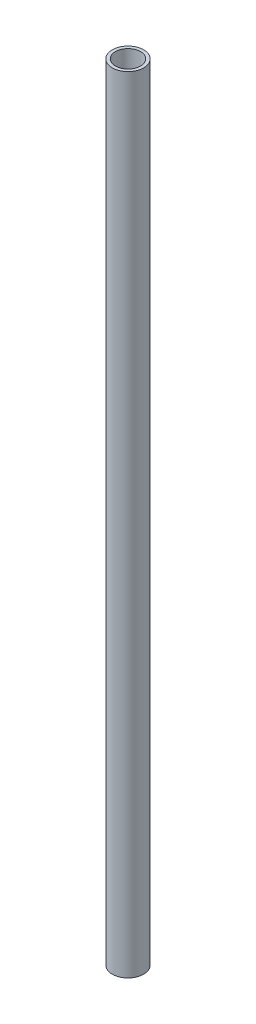
from build123d import *

# Parameters (mm, degrees)
SKETCH_1_R      = 10
SKETCH_1_R_2    = 8
EXTRUDE_1_DEPTH = 500


with BuildPart() as part:
    # 草图1 → 凸台-拉伸1 (new body)
    with BuildSketch(Plane(origin=(0, 0, 0), x_dir=(1, 0, 0), z_dir=(0, 1, 0))):
        with Locations(Location((0, 0, 0), (0, 0, 270))):
            Circle(SKETCH_1_R)
        with Locations(Location((0, 0, 0), (0, 0, 270))):
            Circle(SKETCH_1_R_2, mode=Mode.SUBTRACT)
    extrude(amount=EXTRUDE_1_DEPTH)


solid = part.part
